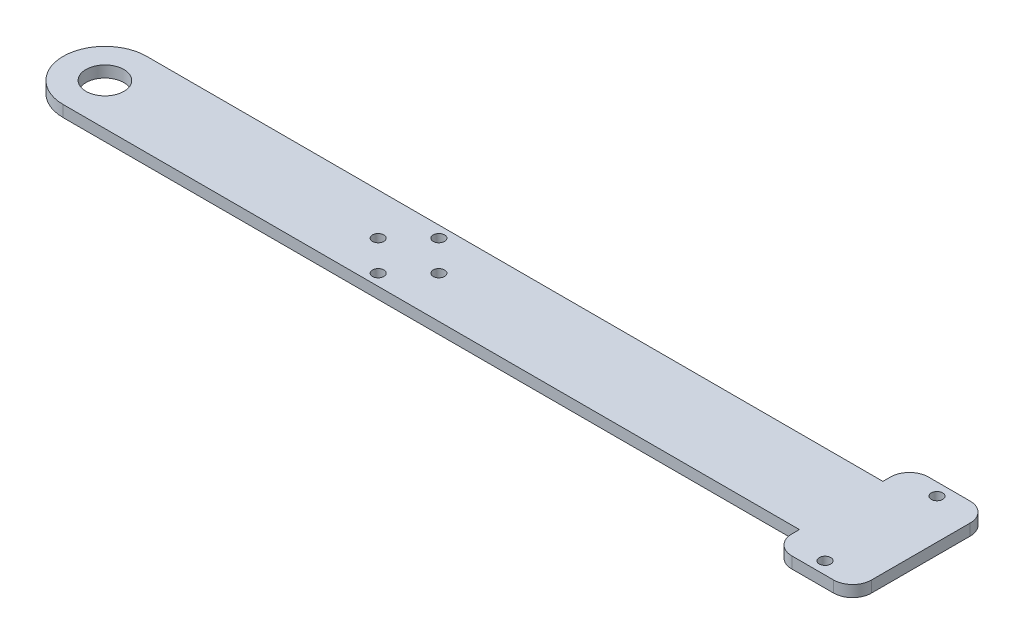
from build123d import *

# Parameters (mm, degrees)
SKETCH_1_R      = 5
SKETCH_1_R_2    = 1.5
EXTRUDE_1_DEPTH = 3


with BuildPart() as part:
    # 草图1 → 凸台-拉伸1 (new body)
    with BuildSketch(Plane(origin=(0, 0, 0), x_dir=(1, 0, 0), z_dir=(0, 1, 0))):
        with BuildLine():
            Line((135, -2), (135, 24))
            ThreePointArc((135, 24), (133.535533906, 27.535533906), (130, 29))
            Line((130, 29), (119, 29))
            ThreePointArc((119, 29), (115.464466094, 27.535533906), (114, 24))
            Line((114, 24), (114, 22))
            Line((114, 22), (0, 22))
            Line((0, 22), (-80, 22))
            ThreePointArc((-80, 22), (-91, 11), (-80, 0))
            Line((-80, 0), (0, 0))
            Line((0, 0), (114, 0))
            Line((114, 0), (114, -2))
            ThreePointArc((114, -2), (115.464466094, -5.535533906), (119, -7))
            Line((119, -7), (130, -7))
            ThreePointArc((130, -7), (133.535533906, -5.535533906), (135, -2))
        make_face()
        with Locations(Location((-80, 11, 0), (0, 0, 270))):
            Circle(SKETCH_1_R, mode=Mode.SUBTRACT)
        with Locations(Location((124.5, 25.75, 0), (0, 0, 270))):
            Circle(SKETCH_1_R_2, mode=Mode.SUBTRACT)
        with Locations(Location((124.5, -3.75, 0), (0, 0, 270))):
            Circle(SKETCH_1_R_2, mode=Mode.SUBTRACT)
        with Locations(Location((0, 19, 0), (0, 0, 270))):
            Circle(SKETCH_1_R_2, mode=Mode.SUBTRACT)
        with Locations(Location((8, 11, 0), (0, 0, 270))):
            Circle(SKETCH_1_R_2, mode=Mode.SUBTRACT)
        with Locations(Location((0, 3, 0), (0, 0, 270))):
            Circle(SKETCH_1_R_2, mode=Mode.SUBTRACT)
        with Locations(Location((-8, 11, 0), (0, 0, 270))):
            Circle(SKETCH_1_R_2, mode=Mode.SUBTRACT)
    extrude(amount=EXTRUDE_1_DEPTH)


solid = part.part
